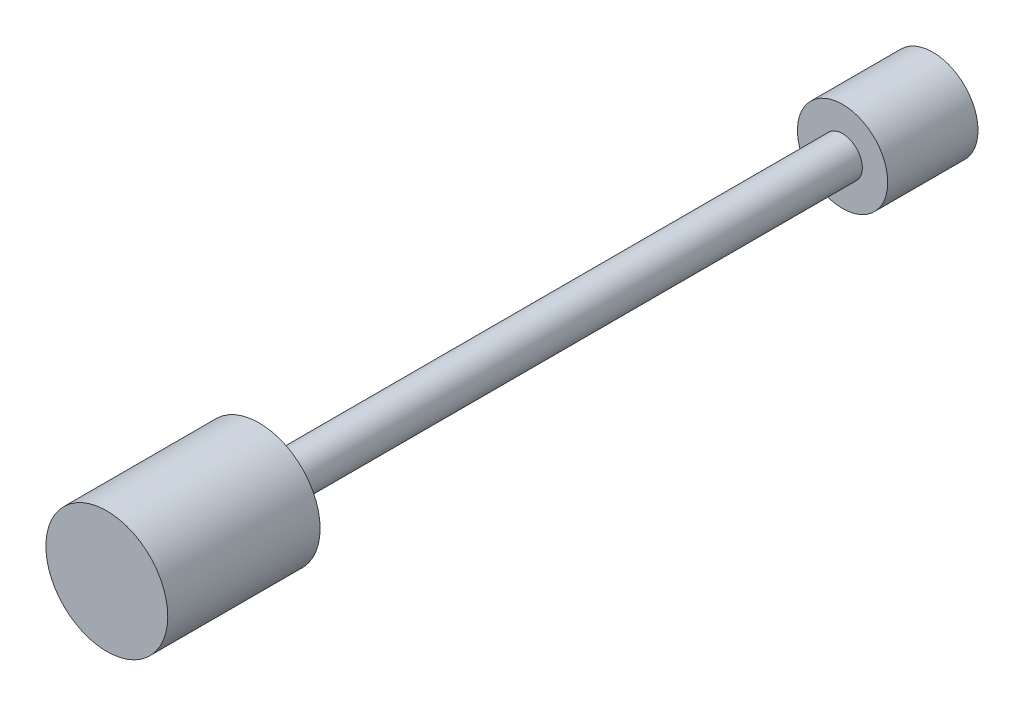
from build123d import *

# Parameters (mm, degrees)
SKETCH1_R           = 4
BOSS_EXTRUDE1_DEPTH = 8
SKETCH2_R           = 1.75
BOSS_EXTRUDE2_DEPTH = 51.7
SKETCH3_R           = 5.4
BOSS_EXTRUDE3_DEPTH = 13.5


with BuildPart() as part:
    # Sketch1 → Boss-Extrude1 (new body)
    with BuildSketch(Plane.XY):
        Circle(SKETCH1_R)
    extrude(amount=BOSS_EXTRUDE1_DEPTH)

    # Sketch2 → Boss-Extrude2 (add)
    with BuildSketch(Plane.XY.offset(8)):
        Circle(SKETCH2_R)
    extrude(amount=BOSS_EXTRUDE2_DEPTH)

    # Sketch3 → Boss-Extrude3 (add)
    with BuildSketch(Plane.XY.offset(59.7)):
        Circle(SKETCH3_R)
    extrude(amount=BOSS_EXTRUDE3_DEPTH)


solid = part.part
